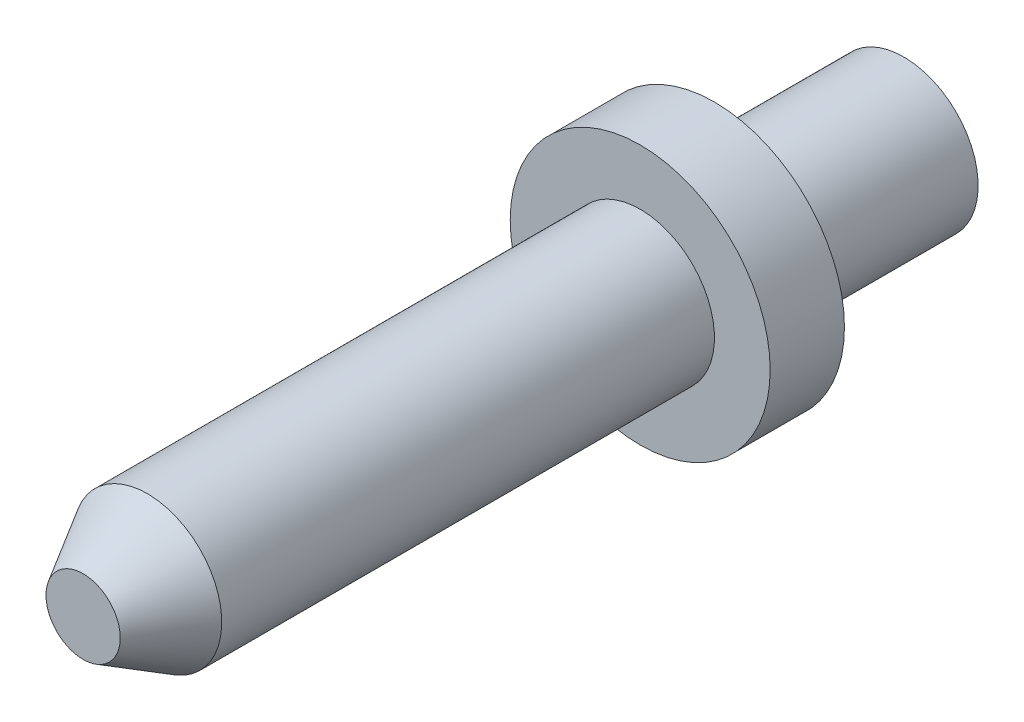
from build123d import *


with BuildPart() as part:
    # Sketch1 → Revolve1 (revolve)
    with BuildSketch(Plane(origin=(0, 0, 0), x_dir=(1, 0, 0), z_dir=(0, 1, 0)), mode=Mode.PRIVATE) as revolve1_sk:
        Polygon((0, 1.702109795), (0, -2.107890205), (0.254, -2.107890205), (0.508, -1.6679493), (0.508, 1.702109795), align=None)
        Polygon((0, 2.210109795), (0, 1.702109795), (0.508, 1.702109795), (0.889, 1.702109795), (0.889, 2.210109795), (0.508, 2.210109795), align=None)
        Polygon((0, 2.32069205), (0, 2.210109795), (0.508, 2.210109795), (0.508, 3.505509795), (0.3175, 3.505509795), (0.3175, 2.489509795), align=None)
    revolve(revolve1_sk.sketch.rotate(Axis((0, 0, -1.702109795), (0, 0, 1)), 180), axis=Axis((0, 0, -1.702109795), (0, 0, 1)))


solid = part.part
